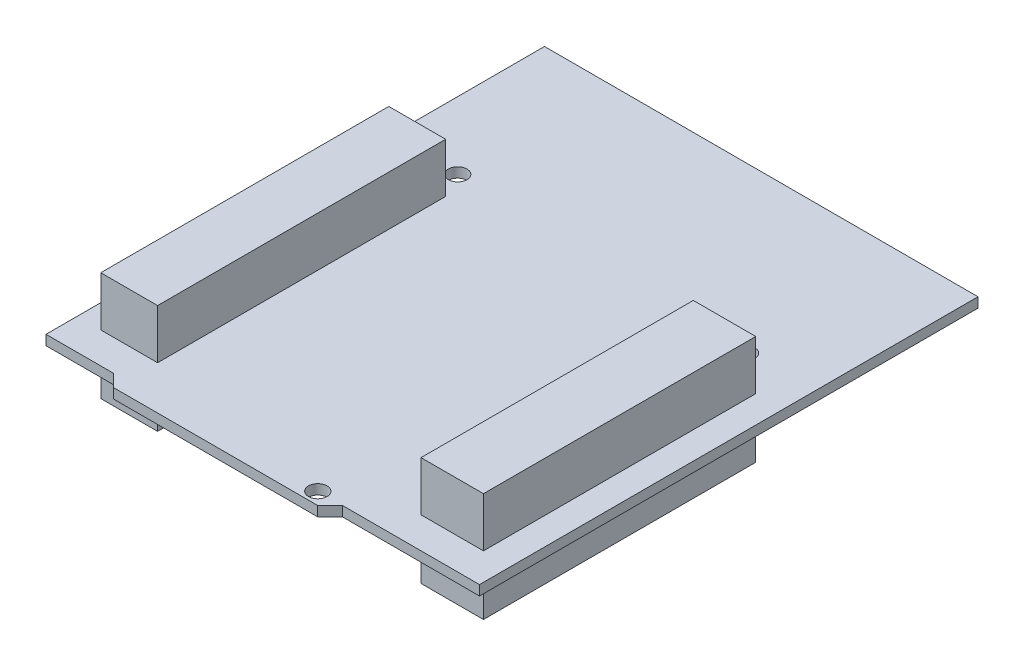
from build123d import *

# Parameters (mm, degrees)
SKETCH1_R                = 1.5
BOSS_EXTRUDE1_DEPTH      = 1.6
BOSS_EXTRUDE2_DEPTH      = 8
BOSS_EXTRUDE2_DEPTH_BACK = 9.6
SKETCH2_W                = 9.179453462
SKETCH2_H                = 46.512773029
SKETCH2_W_2              = 10.081020205
SKETCH2_H_2              = 43.969790628


with BuildPart() as part:
    # Sketch1 → Boss-Extrude1 (new body)
    with BuildSketch(Plane(origin=(0, 0, 0), x_dir=(1, 0, 0), z_dir=(0, 1, 0))):
        Polygon((0, 0), (10.87, 0), (12.87, -2), (45.87, -2), (47.87, 0), (70, 0), (70, 80.5), (0, 80.5), align=None)
        with Locations(Location((10.87, 55.61, 0), (0, 0, 270))):
            Circle(SKETCH1_R, mode=Mode.SUBTRACT)
        with Locations(Location((59.13, 53.84, 0), (0, 0, 270))):
            Circle(SKETCH1_R, mode=Mode.SUBTRACT)
        with Locations(Location((43.89, 0, 0), (0, 0, 270))):
            Circle(SKETCH1_R, mode=Mode.SUBTRACT)
    extrude(amount=BOSS_EXTRUDE1_DEPTH)

    # Sketch2 → Boss-Extrude2 (add, two sides: drawn at the far end of the back side and taken through both)
    with BuildSketch(Plane(origin=(0, 1.6, 0), x_dir=(1, 0, 0), z_dir=(0, 1, 0)).offset(-BOSS_EXTRUDE2_DEPTH_BACK)):
        with Locations((8.40218686, 28.287509228)):
            Rectangle(SKETCH2_W, SKETCH2_H)
        with Locations((60.567754225, 27.016018028)):
            Rectangle(SKETCH2_W_2, SKETCH2_H_2)
    extrude(amount=BOSS_EXTRUDE2_DEPTH + BOSS_EXTRUDE2_DEPTH_BACK)


solid = part.part
